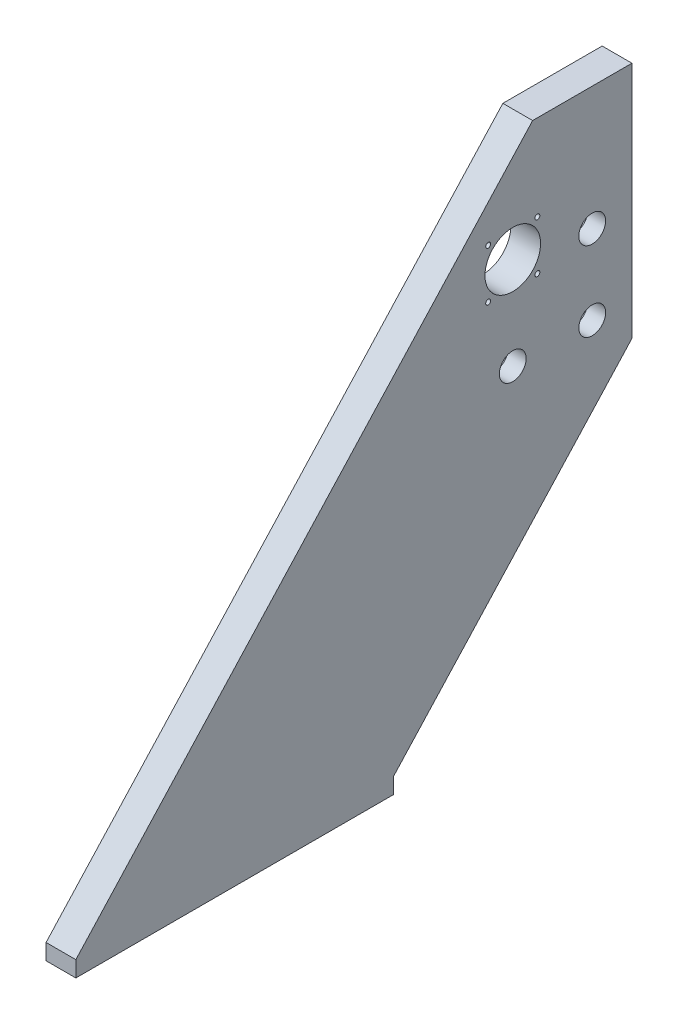
from build123d import *

# Parameters (mm, degrees)
EXTRUDE_738_DEPTH          = 7.5
HOLE_WIZARD_M8_D           = 6.8
HOLE_WIZARD_M8_DEPTH       = 30
HOLE_WIZARD_M8_TIP         = 2.042926105
HOLE_WIZARD_M12_AT_2_COUNT = 2
HOLE_WIZARD_M12_AT_2_PITCH = 40
HOLE_WIZARD_M12_AT_3_COUNT = 2
HOLE_WIZARD_M12_AT_3_PITCH = 56.568542495
SKETCH_12_R                = 14
CUT_EXTRUDE_1_DEPTH        = 328.504072273
FF10_M3_D                  = 2.5
FF10_M3_CSINK_D            = 3.05
FF10_M3_CSINK_ANGLE        = 90


with BuildPart() as part:
    # Эскиз1 → Extrude 738 (new, symmetric)
    with BuildSketch(Plane(origin=(0, 0, 0), x_dir=(0, 0, -1), z_dir=(1, 0, 0))):
        Polygon((-80, 0), (0, 0), (80, 0), (80, 8), (200, 138.909090909), (200, 258.909090909), (150, 258.909090909), (-80, 8), align=None)
    extrude(amount=EXTRUDE_738_DEPTH, both=True)

    # Крепление к плите M8
    with Locations(Plane(origin=(0, 0, 0), x_dir=(-1, 0, 0), z_dir=(0, -1, 0))):
        with Locations((0, -50), (0, 50)):
            Hole(HOLE_WIZARD_M8_D / 2, depth=HOLE_WIZARD_M8_DEPTH)
            with Locations((0, 0, -(HOLE_WIZARD_M8_DEPTH + HOLE_WIZARD_M8_TIP / 2))):  # 118° drill point
                Cone(0, HOLE_WIZARD_M8_D / 2, HOLE_WIZARD_M8_TIP, mode=Mode.SUBTRACT)

    # Эскиз9 → К профилю M12 (revolve, cut)
    with BuildSketch(Plane(origin=(-7.5, 196.809090909, -180), x_dir=(0, 0, 1), z_dir=(0, 1, 0))):
        Polygon((0, 0), (0, 15), (6.75, 15), (6.75, 6), (10, 6), (10, 0.025), (10.025, 0), align=None)
    hole_wizard_m12 = revolve(axis=Axis((-13.85, 196.809090909, -180), (1, 0, 0)), mode=Mode.SUBTRACT)

    # К профилю M12 at 2: К профилю M12 ×2
    with Locations(*[(0, -i * HOLE_WIZARD_M12_AT_2_PITCH, 0) for i in range(1, HOLE_WIZARD_M12_AT_2_COUNT)]):
        add(hole_wizard_m12, mode=Mode.SUBTRACT)

    # К профилю M12 at 3: К профилю M12 ×2
    with Locations(*[Vector(0, -0.7071067811865478, 0.7071067811865474) * (i * HOLE_WIZARD_M12_AT_3_PITCH) for i in range(1, HOLE_WIZARD_M12_AT_3_COUNT)]):
        add(hole_wizard_m12, mode=Mode.SUBTRACT)

    # Эскиз12 → Вырез-Вытянуть1 (cut, through all)
    with BuildSketch(Plane.ZY.offset(7.5)):
        with Locations((-140, 203.31)):
            Circle(SKETCH_12_R)
    extrude(amount=-CUT_EXTRUDE_1_DEPTH, mode=Mode.SUBTRACT)

    # FF10-M3 (through all)
    with Locations(Plane.ZY.offset(7.5)):
        with Locations((-127.625631329, 215.684368671), (-127.625631329, 190.935631329), (-152.374368671, 190.935631329), (-152.374368671, 215.684368671)):
            CounterSinkHole(FF10_M3_D / 2, FF10_M3_CSINK_D / 2, counter_sink_angle=FF10_M3_CSINK_ANGLE)


solid = part.part
